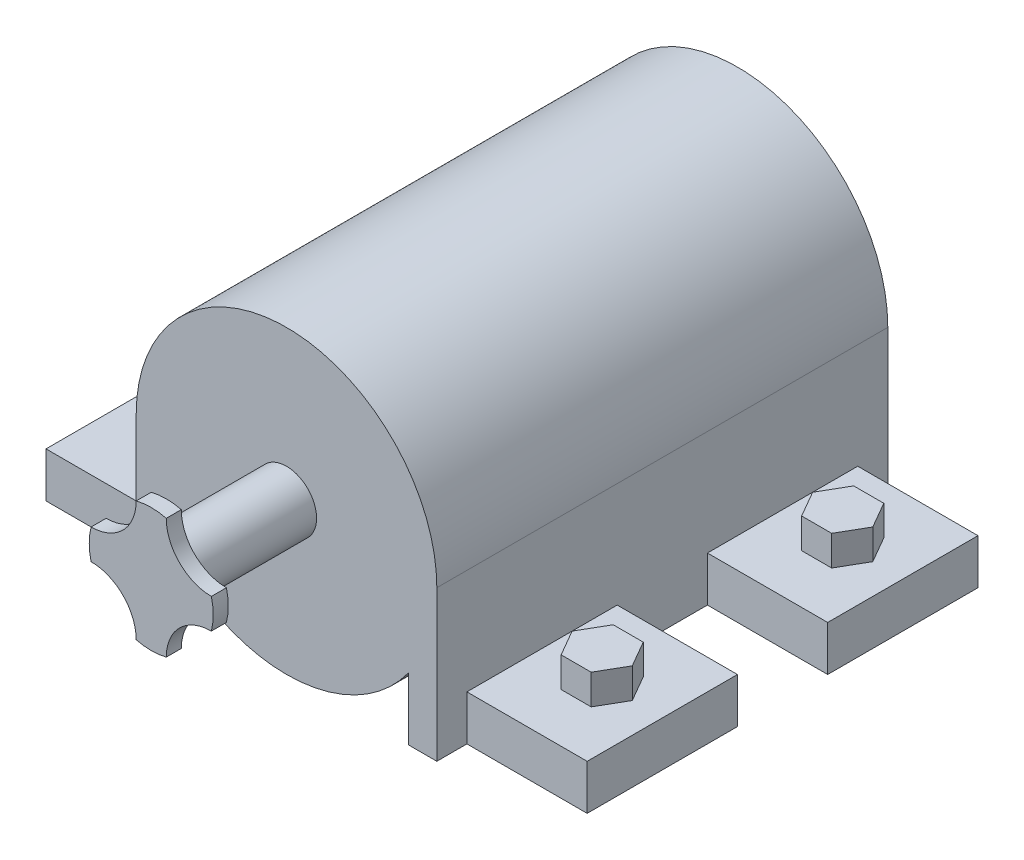
from build123d import *

# Parameters (mm, degrees)
SZKIC1_R                    = 50
DODANIE_WYCI_GNI_CIE1_DEPTH = 150
SZKIC2_R                    = 10
DODANIE_WYCI_GNI_CIE2_DEPTH = 40
DODANIE_WYCI_GNI_CIE3_DEPTH = 5
DODANIE_WYCI_GNI_CIE4_DEPTH = 150
SZKIC5_W                    = 50
SZKIC5_H                    = 15
DODANIE_WYCI_GNI_CIE5_DEPTH = 40
DODANIE_WYCI_GNI_CIE6_DEPTH = 10


with BuildPart() as part:
    # Szkic1 → Dodanie-wyciągnięcie1 (new body)
    with BuildSketch(Plane.XY):
        Circle(SZKIC1_R)
    extrude(amount=DODANIE_WYCI_GNI_CIE1_DEPTH)

    # Szkic2 → Dodanie-wyciągnięcie2 (add)
    with BuildSketch(Plane.XY.offset(150)):
        Circle(SZKIC2_R)
    extrude(amount=DODANIE_WYCI_GNI_CIE2_DEPTH)

    # Szkic3 → Dodanie-wyciągnięcie3 (add)
    with BuildSketch(Plane.XY.offset(190)):
        with BuildLine():
            ThreePointArc((-5, -20), (-9.393398282, -9.393398282), (-20, -5))
            ThreePointArc((-20, -5), (-20.615528128, 0), (-20, 5))
            ThreePointArc((-20, 5), (-9.393398282, 9.393398282), (-5, 20))
            ThreePointArc((-5, 20), (0, 20.615528128), (5, 20))
            ThreePointArc((5, 20), (9.393398282, 9.393398282), (20, 5))
            ThreePointArc((20, 5), (20.615528128, 0), (20, -5))
            ThreePointArc((20, -5), (9.393398282, -9.393398282), (5, -20))
            ThreePointArc((5, -20), (0, -20.615528128), (-5, -20))
        make_face()
    extrude(amount=DODANIE_WYCI_GNI_CIE3_DEPTH)

    # Szkic4 → Dodanie-wyciągnięcie4 (add)
    with BuildSketch(Plane.XY):
        Polygon((-50, 0), (-50, -50), (-40.610421469, -50), (-40.610421469, -29.168367595), align=None)
    dodanie_wyci_gni_cie4 = extrude(amount=DODANIE_WYCI_GNI_CIE4_DEPTH)

    # Szkic5 → Dodanie-wyciągnięcie5 (add)
    with BuildSketch(Plane.ZY.offset(50)):
        with Locations((35, -42.5)):
            Rectangle(SZKIC5_W, SZKIC5_H)
        with Locations((115, -42.5)):
            Rectangle(SZKIC5_W, SZKIC5_H)
    dodanie_wyci_gni_cie5 = extrude(amount=DODANIE_WYCI_GNI_CIE5_DEPTH)

    # Szkic6 → Dodanie-wyciągnięcie6 (add)
    with BuildSketch(Plane(origin=(0, -35, 0), x_dir=(1, 0, 0), z_dir=(0, 1, 0))):
        Polygon((-65, -26.339745962), (-75, -26.339745962), (-80, -35), (-75, -43.660254038), (-65, -43.660254038), (-60, -35), align=None)
        Polygon((-60, -115), (-65, -106.339745962), (-75, -106.339745962), (-80, -115), (-75, -123.660254038), (-65, -123.660254038), align=None)
    dodanie_wyci_gni_cie6 = extrude(amount=DODANIE_WYCI_GNI_CIE6_DEPTH)

    # Lustro1: Dodanie-wyciągnięcie4, Dodanie-wyciągnięcie5, Dodanie-wyciągnięcie6 across plane
    add(dodanie_wyci_gni_cie4.mirror(Plane(origin=(0, 0, 0), x_dir=(0, 0, 1), z_dir=(1, 0, 0))))
    add(dodanie_wyci_gni_cie5.mirror(Plane(origin=(0, 0, 0), x_dir=(0, 0, 1), z_dir=(1, 0, 0))))
    add(dodanie_wyci_gni_cie6.mirror(Plane(origin=(0, 0, 0), x_dir=(0, 0, 1), z_dir=(1, 0, 0))))


solid = part.part
